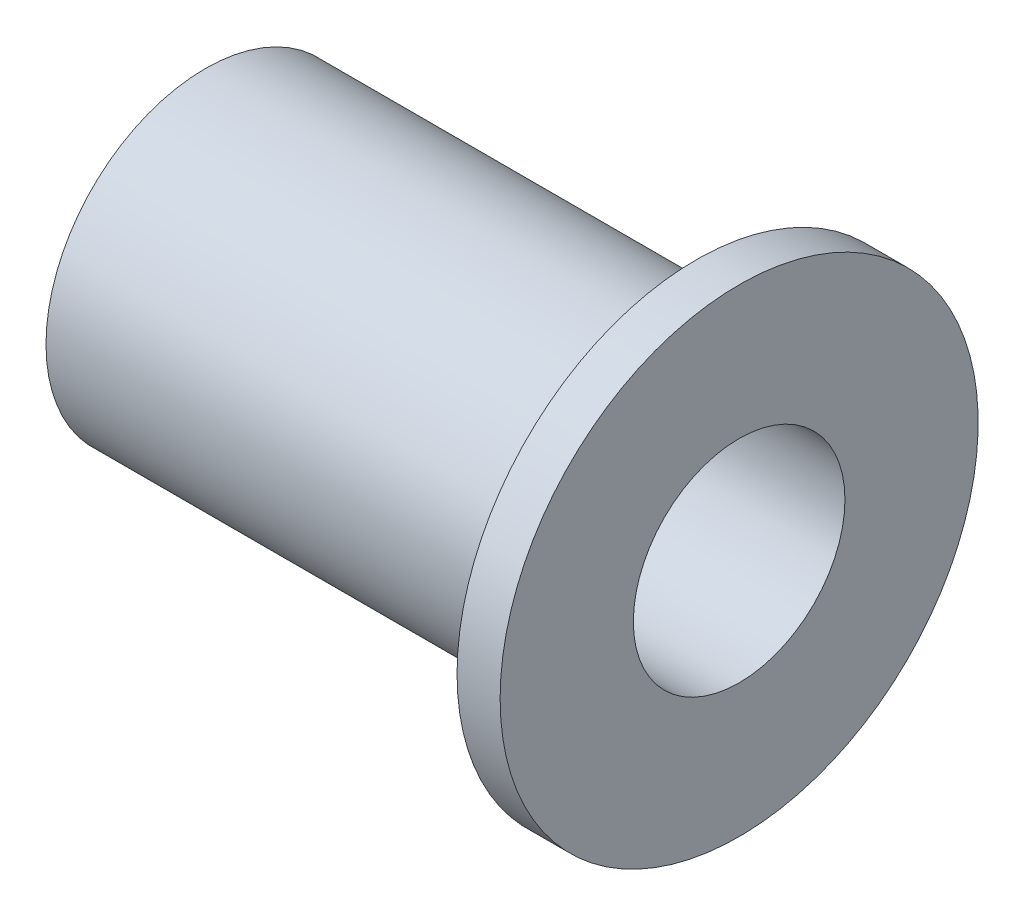
from build123d import *


with BuildPart() as part:
    # Schizzo1 → Rivoluzione1 (revolve)
    with BuildSketch(Plane.XY, mode=Mode.PRIVATE) as rivoluzione1_sk:
        Polygon((0, -1.99), (0, -2.995), (9.23, -2.995), (9.23, -4.495), (10.04, -4.495), (10.04, -1.99), align=None)
    revolve(rivoluzione1_sk.sketch.rotate(Axis((0, 0, 0), (1, 0, 0)), 270), axis=Axis((0, 0, 0), (1, 0, 0)))


solid = part.part
